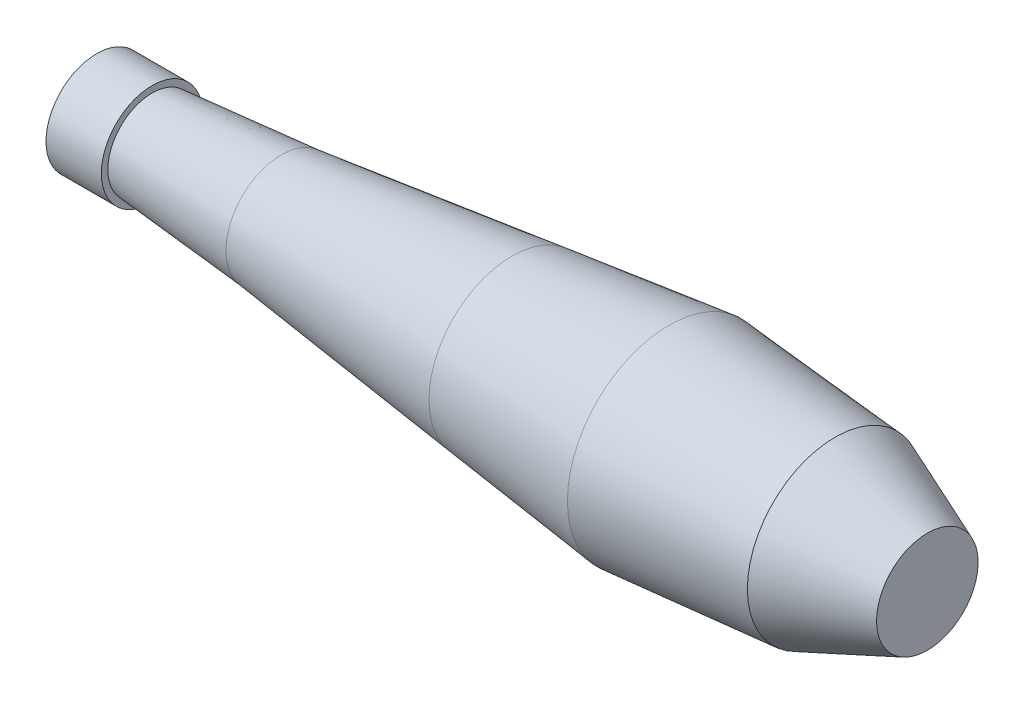
from build123d import *


with BuildPart() as part:
    # Sketch1 → Revolve1 (revolve)
    with BuildSketch(Plane.XY):
        Polygon((0, 0), (0, 5.5), (6, 5.5), (6, 4.8), (20, 6), (45, 9), (62, 11), (80, 9.5), (90, 5.5), (90, 0), align=None)
    revolve(axis=Axis((0, 0, 0), (1, 0, 0)))


solid = part.part
